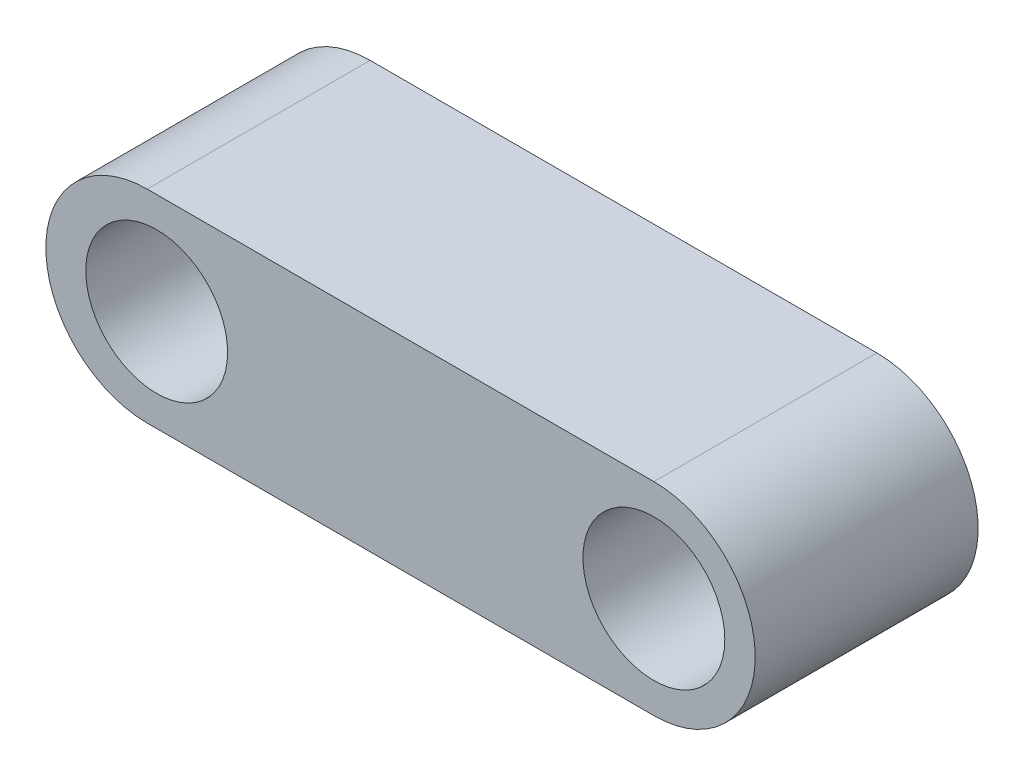
from build123d import *

# Parameters (mm, degrees)
SKETCH1_R           = 5
SKETCH1_W           = 25
SKETCH1_H           = 10
BOSS_EXTRUDE1_DEPTH = 11
SKETCH2_R           = 3.5
CUT_EXTRUDE1_DEPTH  = 11


with BuildPart() as part:
    # Sketch1 → Boss-Extrude1 (new body)
    with BuildSketch(Plane.XY):
        with Locations((25, -5)):
            Circle(SKETCH1_R)
        with Locations((0, -5)):
            Circle(SKETCH1_R)
        with Locations((12.5, -5)):
            Rectangle(SKETCH1_W, SKETCH1_H)
    extrude(amount=BOSS_EXTRUDE1_DEPTH)

    # Sketch2 → Cut-Extrude1 (cut)
    with BuildSketch(Plane.XY.offset(11)):
        with Locations((0.469346028, -5)):
            Circle(SKETCH2_R)
        with Locations((25, -5)):
            Circle(SKETCH2_R)
    extrude(amount=-CUT_EXTRUDE1_DEPTH, mode=Mode.SUBTRACT)


solid = part.part
